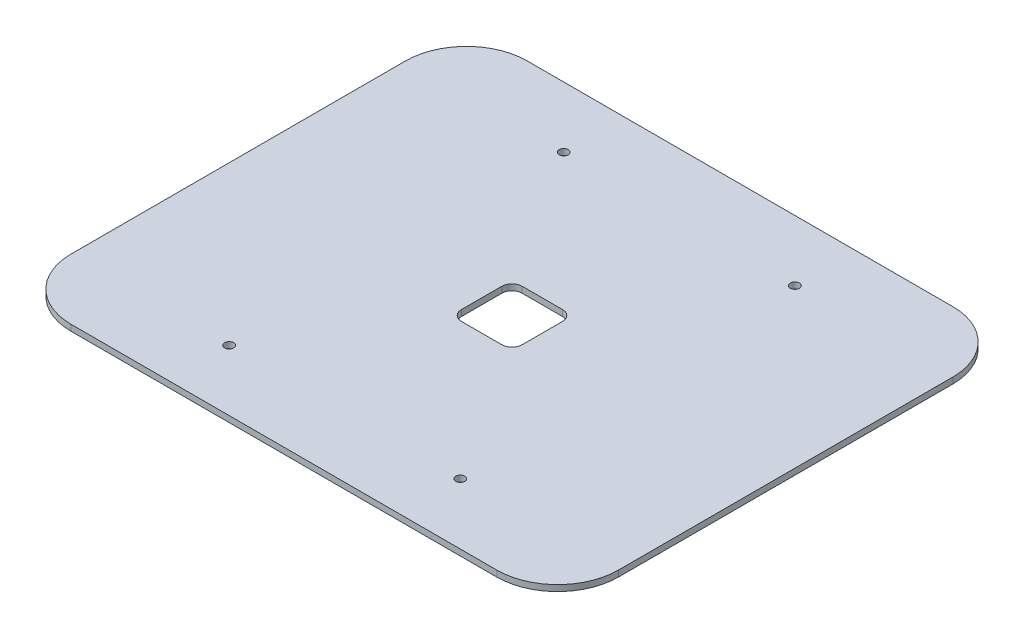
from build123d import *

# Parameters (mm, degrees)
RESSALTO_EXTRUS_O1_DEPTH = 2
ESBO_O2_R                = 1.5
CORTE_EXTRUS_O1_DEPTH    = 10
CORTE_EXTRUS_O2_DEPTH    = 10


with BuildPart() as part:
    # Esboço1 → Ressalto-extrusão1 (new body)
    with BuildSketch(Plane(origin=(0, 0, 0), x_dir=(1, 0, 0), z_dir=(0, 1, 0))):
        with BuildLine():
            Line((-40.816022398, 183.1144834), (99.183977602, 183.1144834))
            ThreePointArc((99.183977602, 183.1144834), (113.326113225, 177.256619024), (119.183977602, 163.1144834))
            Line((119.183977602, 163.1144834), (119.183977602, 53.1144834))
            ThreePointArc((119.183977602, 53.1144834), (113.326113225, 38.972347776), (99.183977602, 33.1144834))
            Line((99.183977602, 33.1144834), (-40.816022398, 33.1144834))
            ThreePointArc((-40.816022398, 33.1144834), (-54.958158022, 38.972347776), (-60.816022398, 53.1144834))
            Line((-60.816022398, 53.1144834), (-60.816022398, 163.1144834))
            ThreePointArc((-60.816022398, 163.1144834), (-54.958158022, 177.256619024), (-40.816022398, 183.1144834))
        make_face()
    extrude(amount=RESSALTO_EXTRUS_O1_DEPTH)

    # Esboço2 → Corte-extrusão1 (cut)
    with BuildSketch(Plane(origin=(0, 2, 0), x_dir=(1, 0, 0), z_dir=(0, 1, 0))):
        with Locations(Location((-8.816022398, 163.1144834, 0), (0, 0, 270))):
            Circle(ESBO_O2_R)
        with Locations(Location((67.183977602, 163.1144834, 0), (0, 0, 270))):
            Circle(ESBO_O2_R)
        with Locations(Location((67.183977602, 53.1144834, 0), (0, 0, 270))):
            Circle(ESBO_O2_R)
        with Locations(Location((-8.816022398, 53.1144834, 0), (0, 0, 270))):
            Circle(ESBO_O2_R)
    extrude(amount=-CORTE_EXTRUS_O1_DEPTH, mode=Mode.SUBTRACT)

    # Esboço3 → Corte-extrusão2 (cut)
    with BuildSketch(Plane(origin=(0, 2, 0), x_dir=(1, 0, 0), z_dir=(0, 1, 0))):
        with BuildLine():
            Line((22.553213858, 118.1144834), (35.814741345, 118.1144834))
            ThreePointArc((35.814741345, 118.1144834), (38.19715115, 117.127656948), (39.183977602, 114.745247144))
            Line((39.183977602, 114.745247144), (39.183977602, 101.483719656))
            ThreePointArc((39.183977602, 101.483719656), (38.19715115, 99.101309852), (35.814741345, 98.1144834))
            Line((35.814741345, 98.1144834), (22.553213858, 98.1144834))
            ThreePointArc((22.553213858, 98.1144834), (20.170804054, 99.101309852), (19.183977602, 101.483719656))
            Line((19.183977602, 101.483719656), (19.183977602, 114.745247144))
            ThreePointArc((19.183977602, 114.745247144), (20.170804054, 117.127656948), (22.553213858, 118.1144834))
        make_face()
    extrude(amount=-CORTE_EXTRUS_O2_DEPTH, mode=Mode.SUBTRACT)


solid = part.part
